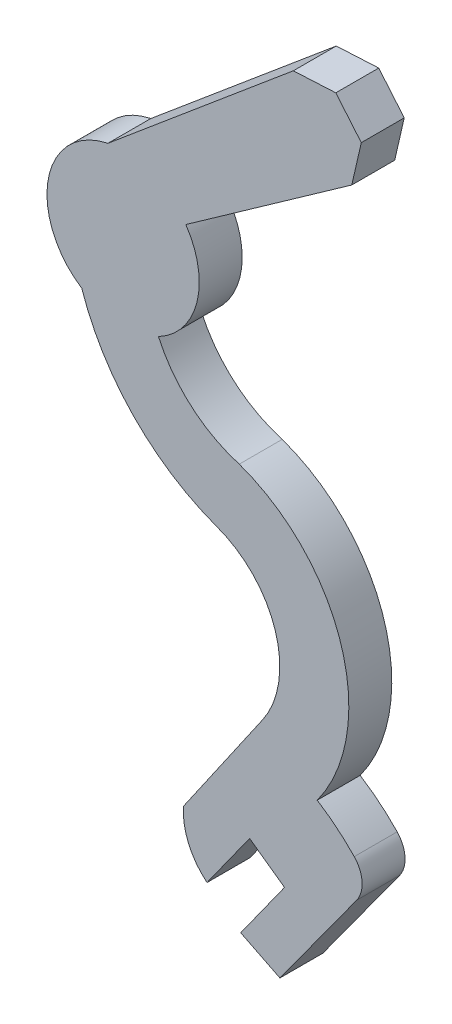
from build123d import *

# Parameters (mm, degrees)
BASE_EXTRUDE_DEPTH = 3


with BuildPart() as part:
    # Sketch1 → Base-Extrude (new body)
    with BuildSketch(Plane.XY):
        with BuildLine():
            Line((1209.451820501, 108.09887988), (1211.233559267, 105.974449758))
            Line((1211.233559267, 105.974449758), (1210.568605008, 103.078332754))
            Line((1210.568605008, 103.078332754), (1198.969787726, 94.887573091))
            ThreePointArc((1198.969787726, 94.887573091), (1199.754979333, 90.590746745), (1197.058986008, 87.154053204))
            ThreePointArc((1197.058986008, 87.154053204), (1199.345903518, 84.086132658), (1202.705960658, 82.255246482))
            ThreePointArc((1202.705960658, 82.255246482), (1209.850323306, 74.816142589), (1208.153154203, 64.64255908))
            ThreePointArc((1208.153154203, 64.64255908), (1209.513439683, 63.663584022), (1210.741786407, 62.523437946))
            ThreePointArc((1210.741786407, 62.523437946), (1211.288328706, 61.27741643), (1210.911264244, 59.970090727))
            Line((1210.911264244, 59.970090727), (1205.547364782, 52.580569169))
            Line((1205.547364782, 52.580569169), (1202.809005818, 53.947443229))
            Line((1202.809005818, 53.947443229), (1205.868102338, 58.222609567))
            Line((1205.868102338, 58.222609567), (1203.428362014, 59.968366467))
            Line((1203.428362014, 59.968366467), (1200.451593647, 55.808255846))
            ThreePointArc((1200.451593647, 55.808255846), (1199.171644978, 57.50635778), (1198.80528387, 59.601017254))
            Line((1198.80528387, 59.601017254), (1204.319471793, 67.576551504))
            ThreePointArc((1204.319471793, 67.576551504), (1205.223941879, 73.442636449), (1201.095098665, 77.706633686))
            ThreePointArc((1201.095098665, 77.706633686), (1195.300986917, 81.489736173), (1191.700510295, 87.399064684))
            ThreePointArc((1191.700510295, 87.399064684), (1189.361079278, 92.852732142), (1193.525678388, 97.080206622))
            Line((1193.525678388, 97.080206622), (1206.484161244, 107.948359455))
            Line((1206.484161244, 107.948359455), (1209.451820501, 108.09887988))
        make_face()
    extrude(amount=BASE_EXTRUDE_DEPTH)


solid = part.part
